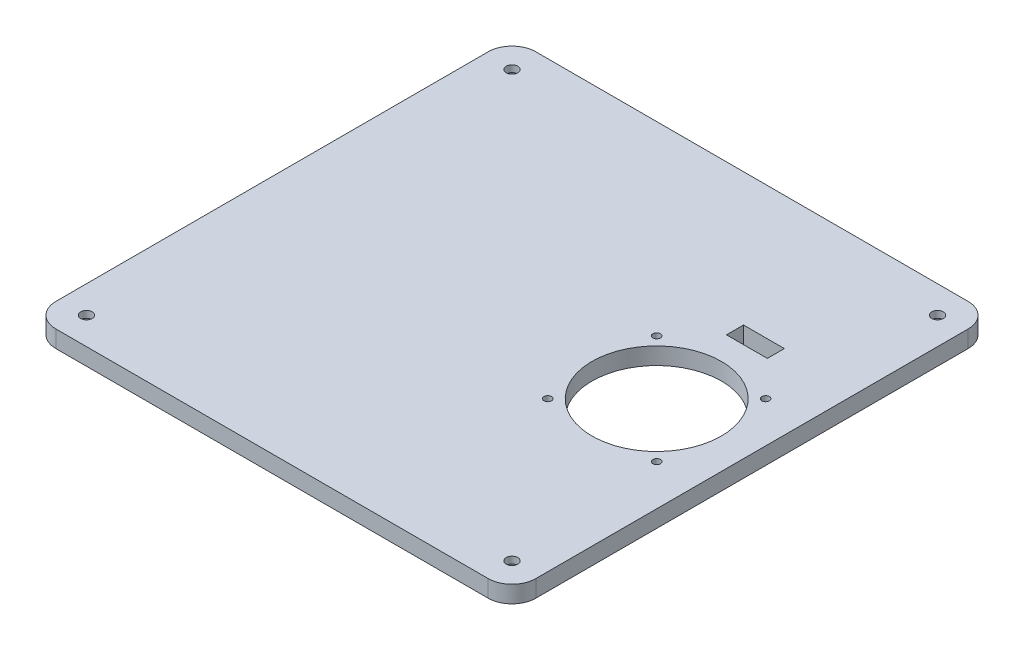
from build123d import *

# Parameters (mm, degrees)
SKETCH1_W                      = 141
SKETCH1_H                      = 141
BOSS_EXTRUDE1_DEPTH            = 5
CUT_EXTRUDE1_REACH             = 101.827
SKETCH3_R                      = 1.1
CBORE_FOR_M3_SHCS1_D           = 3.4
CBORE_FOR_M3_SHCS1_CBORE_D     = 6.5
CBORE_FOR_M3_SHCS1_CBORE_DEPTH = 3
FILLET1_R                      = 7
ESQUISSE1_R                    = 19
ENL_V_MAT_EXTRU_1_DEPTH        = 100.827350962
ESQUISSE2_W                    = 12
ESQUISSE2_H                    = 5
ENL_V_MAT_EXTRU_2_DEPTH        = 100.827350962


with BuildPart() as part:
    # Sketch1 → Boss-Extrude1 (new body)
    with BuildSketch(Plane(origin=(0, 0, 0), x_dir=(1, 0, 0), z_dir=(0, 1, 0))):
        Rectangle(SKETCH1_W, SKETCH1_H)
    extrude(amount=BOSS_EXTRUDE1_DEPTH)

    # Sketch3 → Cut-Extrude1 (cut, up to next)
    with BuildSketch(Plane(origin=(0, 5, 0), x_dir=(1, 0, 0), z_dir=(0, 1, 0)), mode=Mode.PRIVATE) as cut_extrude1_sk1:
        with Locations(Location((26.5, 16, 0), (0, 0, 270))):
            Circle(SKETCH3_R)
    cut_extrude1_tool1 = extrude(cut_extrude1_sk1.sketch, amount=-CUT_EXTRUDE1_REACH, mode=Mode.PRIVATE) & part.part
    # Sketch3 → Cut-Extrude1 (cut, up to next)
    with BuildSketch(Plane(origin=(0, 5, 0), x_dir=(1, 0, 0), z_dir=(0, 1, 0)), mode=Mode.PRIVATE) as cut_extrude1_sk2:
        with Locations(Location((58.5, 16, 0), (0, 0, 270))):
            Circle(SKETCH3_R)
    cut_extrude1_tool2 = extrude(cut_extrude1_sk2.sketch, amount=-CUT_EXTRUDE1_REACH, mode=Mode.PRIVATE) & part.part
    # Sketch3 → Cut-Extrude1 (cut, up to next)
    with BuildSketch(Plane(origin=(0, 5, 0), x_dir=(1, 0, 0), z_dir=(0, 1, 0)), mode=Mode.PRIVATE) as cut_extrude1_sk3:
        with Locations(Location((58.5, -16, 0), (0, 0, 270))):
            Circle(SKETCH3_R)
    cut_extrude1_tool3 = extrude(cut_extrude1_sk3.sketch, amount=-CUT_EXTRUDE1_REACH, mode=Mode.PRIVATE) & part.part
    # Sketch3 → Cut-Extrude1 (cut, up to next)
    with BuildSketch(Plane(origin=(0, 5, 0), x_dir=(1, 0, 0), z_dir=(0, 1, 0)), mode=Mode.PRIVATE) as cut_extrude1_sk4:
        with Locations(Location((26.5, -16, 0), (0, 0, 270))):
            Circle(SKETCH3_R)
    cut_extrude1_tool4 = extrude(cut_extrude1_sk4.sketch, amount=-CUT_EXTRUDE1_REACH, mode=Mode.PRIVATE) & part.part
    add(cut_extrude1_tool1.solids().sort_by_distance((26.5, 5, -16))[0], mode=Mode.SUBTRACT)
    add(cut_extrude1_tool2.solids().sort_by_distance((58.5, 5, -16))[0], mode=Mode.SUBTRACT)
    add(cut_extrude1_tool3.solids().sort_by_distance((58.5, 5, 16))[0], mode=Mode.SUBTRACT)
    add(cut_extrude1_tool4.solids().sort_by_distance((26.5, 5, 16))[0], mode=Mode.SUBTRACT)

    # CBORE for M3 SHCS1 (through all)
    with Locations(Plane(origin=(-62.5, 0, 62.5), x_dir=(0, 0, -1), z_dir=(0, -1, 0))):
        with Locations((0, 0), (125, 0), (125, 125), (0, 125)):
            CounterBoreHole(CBORE_FOR_M3_SHCS1_D / 2, CBORE_FOR_M3_SHCS1_CBORE_D / 2, CBORE_FOR_M3_SHCS1_CBORE_DEPTH)

    # Fillet1
    fillet1_edges = [part.edges().sort_by_distance(p)[0] for p in [
        (70.5, 2.5, 70.5),
        (-70.5, 2.5, 70.5),
        (-70.5, 2.5, -70.5),
        (70.5, 2.5, -70.5),
    ]]
    fillet(fillet1_edges, radius=FILLET1_R)

    # Esquisse1 → Enlèv. mat.-Extru.1 (cut, through all)
    with BuildSketch(Plane.XZ):
        with Locations(Location((42.5, 0, 0), (0, 0, 270))):
            Circle(ESQUISSE1_R)
    extrude(amount=-ENL_V_MAT_EXTRU_1_DEPTH, mode=Mode.SUBTRACT)

    # Esquisse2 → Enlèv. mat.-Extru.2 (cut, through all)
    with BuildSketch(Plane.XZ):
        with Locations((42.5, -29)):
            Rectangle(ESQUISSE2_W, ESQUISSE2_H)
    extrude(amount=-ENL_V_MAT_EXTRU_2_DEPTH, mode=Mode.SUBTRACT)


solid = part.part
